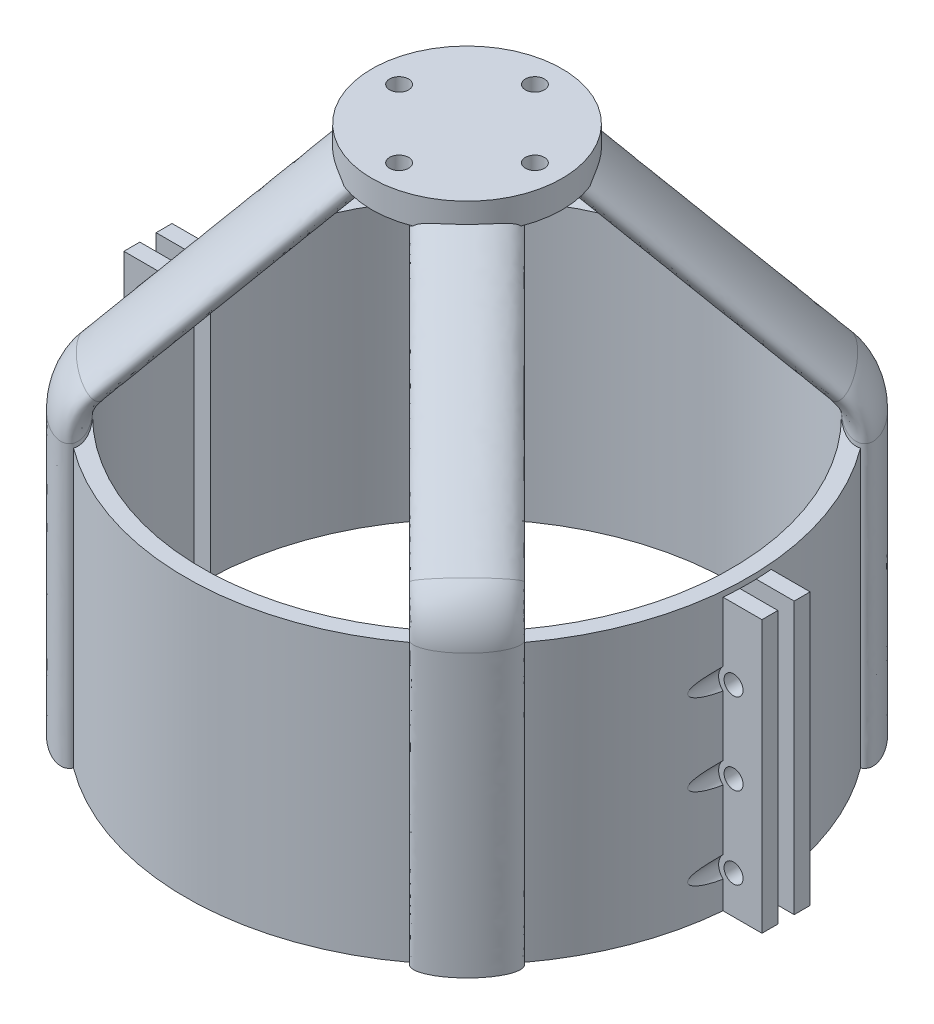
from build123d import *

# Parameters (mm, degrees)
BOSS_EXTRUDE1_DEPTH      = 50
BOSS_EXTRUDE1_2_DEPTH    = 50
SKETCH2_R                = 1.75
CUT_EXTRUDE1_DEPTH       = 96.421557242
CUT_EXTRUDE3_START       = 50
SKETCH3_R                = 2.75
SKETCH3_R_2              = 1.75
CUT_EXTRUDE3_DEPTH       = 50
SKETCH5_R                = 2.75
SKETCH5_R_2              = 1.75
CUT_EXTRUDE4_DEPTH       = 50
SKETCH10_RX              = 7.5
SKETCH10_RY              = 3
SKETCH11_R               = 51.75
SKETCH11_R_2             = 48.75
BOSS_EXTRUDE2_DEPTH      = 1
CIRPATTERN3_COUNT        = 4
BOSS_EXTRUDE3_DEPTH      = 2.5
BOSS_EXTRUDE3_DEPTH_BACK = 2.5
SKETCH12_R               = 17.5
SKETCH13_R               = 1.75
CUT_EXTRUDE5_DEPTH       = 5


with BuildPart() as part:
    # Sketch1 → Boss-Extrude1 (new body)
    with BuildSketch(Plane(origin=(0, 0, 0), x_dir=(1, 0, 0), z_dir=(0, 1, 0))):
        with BuildLine():
            Line((-58.726917612, -4.432049928), (-51.55986262, -4.432049928))
            ThreePointArc((-51.55986262, -4.432049928), (0, -51.75), (51.55986262, -4.432049928))
            Line((51.55986262, -4.432049928), (58.726917612, -4.432049928))
            Line((58.726917612, -4.432049928), (58.726917612, -1.5))
            Line((58.726917612, -1.5), (48.726917612, -1.5))
            ThreePointArc((48.726917612, -1.5), (0, -48.75), (-48.726917612, -1.5))
            Line((-48.726917612, -1.5), (-58.726917612, -1.5))
            Line((-58.726917612, -1.5), (-58.726917612, -4.432049928))
        make_face()
    extrude(amount=BOSS_EXTRUDE1_DEPTH)


with BuildPart() as body_2:
    # Sketch1 → Boss-Extrude1 2 (new body)
    with BuildSketch(Plane(origin=(0, 0, 0), x_dir=(1, 0, 0), z_dir=(0, 1, 0))):
        with BuildLine():
            ThreePointArc((51.55986262, 4.432049928), (0, 51.75), (-51.55986262, 4.432049928))
            Line((-51.55986262, 4.432049928), (-58.726917612, 4.432049928))
            Line((-58.726917612, 4.432049928), (-58.726917612, 1.5))
            Line((-58.726917612, 1.5), (-48.726917612, 1.5))
            ThreePointArc((-48.726917612, 1.5), (0, 48.75), (48.726917612, 1.5))
            Line((48.726917612, 1.5), (58.726917612, 1.5))
            Line((58.726917612, 1.5), (58.726917612, 4.432049928))
            Line((58.726917612, 4.432049928), (51.55986262, 4.432049928))
        make_face()
    extrude(amount=BOSS_EXTRUDE1_2_DEPTH)


with BuildPart() as cut_extrude1_tool:
    # Sketch2 → Cut-Extrude1 (new, through all)
    with BuildSketch(Plane.XY.offset(4.432049928)):
        with Locations((-53.5, 7)):
            Circle(SKETCH2_R)
        with Locations((-53.5, 22)):
            Circle(SKETCH2_R)
        with Locations((-53.5, 37)):
            Circle(SKETCH2_R)
        with Locations((53.5, 7)):
            Circle(SKETCH2_R)
        with Locations((53.5, 22)):
            Circle(SKETCH2_R)
        with Locations((53.5, 37)):
            Circle(SKETCH2_R)
    extrude(amount=-CUT_EXTRUDE1_DEPTH)


with BuildPart() as part_1:
    add(part.part)

    # Cut-Extrude1: cut by cut_extrude1_tool
    add(cut_extrude1_tool.part, mode=Mode.SUBTRACT)

    # Sketch3 → Cut-Extrude3 (cut)
    # profile 1 of 6: a face of its own
    with BuildSketch(Plane.XY.offset(4.432049928).offset(CUT_EXTRUDE3_START)):
        with Locations((-53.5, 37)):
            Circle(SKETCH3_R)
        with Locations((-53.5, 37)):
            Circle(SKETCH3_R_2, mode=Mode.SUBTRACT)
    # profile 2 of 6: a face of its own
    with BuildSketch(Plane.XY.offset(4.432049928).offset(CUT_EXTRUDE3_START)):
        with Locations((-53.5, 22)):
            Circle(SKETCH3_R)
        with Locations((-53.5, 22)):
            Circle(SKETCH3_R_2, mode=Mode.SUBTRACT)
    # profile 3 of 6: a face of its own
    with BuildSketch(Plane.XY.offset(4.432049928).offset(CUT_EXTRUDE3_START)):
        with Locations((-53.5, 7)):
            Circle(SKETCH3_R)
        with Locations((-53.5, 7)):
            Circle(SKETCH3_R_2, mode=Mode.SUBTRACT)
    # profile 4 of 6: a face of its own
    with BuildSketch(Plane.XY.offset(4.432049928).offset(CUT_EXTRUDE3_START)):
        with Locations((53.5, 7)):
            Circle(SKETCH3_R)
        with Locations((53.5, 7)):
            Circle(SKETCH3_R_2, mode=Mode.SUBTRACT)
    # profile 5 of 6: a face of its own
    with BuildSketch(Plane.XY.offset(4.432049928).offset(CUT_EXTRUDE3_START)):
        with Locations((53.5, 22)):
            Circle(SKETCH3_R)
        with Locations((53.5, 22)):
            Circle(SKETCH3_R_2, mode=Mode.SUBTRACT)
    # profile 6 of 6: a face of its own
    with BuildSketch(Plane.XY.offset(4.432049928).offset(CUT_EXTRUDE3_START)):
        with Locations((53.5, 37)):
            Circle(SKETCH3_R)
        with Locations((53.5, 37)):
            Circle(SKETCH3_R_2, mode=Mode.SUBTRACT)
    extrude(amount=-CUT_EXTRUDE3_DEPTH, mode=Mode.SUBTRACT)

    # Sweep1: sweep along a path in Sketch9
    with BuildLine(Plane(origin=(0, 0, 0), x_dir=(0.7071067811865475, 0, -0.7071067811865477), z_dir=(0.7071067811865477, 0, 0.7071067811865475))) as sweep1_path:
        Line((-51.75, 0), (-51.75, 51.772072046))
        ThreePointArc((-51.75, 51.772072046), (-50.971269713, 55.640945896), (-48.756363025, 58.907257899))
        Line((-48.756363025, 58.907257899), (-12, 95))
    # Sketch10 → Sweep1 (sweep)
    with BuildSketch(Plane.XZ):
        with Locations(Location((-36.592775926, 36.592775926), (0, 0, 45))):
            Ellipse(SKETCH10_RX, SKETCH10_RY)
    sweep1 = sweep(path=sweep1_path.line)



with BuildPart() as body_2_1:
    add(body_2.part)

    # Cut-Extrude1: cut by cut_extrude1_tool
    add(cut_extrude1_tool.part, mode=Mode.SUBTRACT)

    # Sketch5 → Cut-Extrude4 (cut)
    # profile 1 of 6: a face of its own
    with BuildSketch(Plane(origin=(0, 0, -4.432049928), x_dir=(-1, 0, 0), z_dir=(0, 0, -1))):
        with Locations((-53.5, 37)):
            Circle(SKETCH5_R)
        with Locations(Location((-53.5, 37, 0), (0, 0, 180))):
            Circle(SKETCH5_R_2, mode=Mode.SUBTRACT)
    # profile 2 of 6: a face of its own
    with BuildSketch(Plane(origin=(0, 0, -4.432049928), x_dir=(-1, 0, 0), z_dir=(0, 0, -1))):
        with Locations((-53.5, 22)):
            Circle(SKETCH5_R)
        with Locations(Location((-53.5, 22, 0), (0, 0, 180))):
            Circle(SKETCH5_R_2, mode=Mode.SUBTRACT)
    # profile 3 of 6: a face of its own
    with BuildSketch(Plane(origin=(0, 0, -4.432049928), x_dir=(-1, 0, 0), z_dir=(0, 0, -1))):
        with Locations((-53.5, 7)):
            Circle(SKETCH5_R)
        with Locations(Location((-53.5, 7, 0), (0, 0, 180))):
            Circle(SKETCH5_R_2, mode=Mode.SUBTRACT)
    # profile 4 of 6: a face of its own
    with BuildSketch(Plane(origin=(0, 0, -4.432049928), x_dir=(-1, 0, 0), z_dir=(0, 0, -1))):
        with Locations((53.5, 7)):
            Circle(SKETCH5_R)
        with Locations(Location((53.5, 7, 0), (0, 0, 180))):
            Circle(SKETCH5_R_2, mode=Mode.SUBTRACT)
    # profile 5 of 6: a face of its own
    with BuildSketch(Plane(origin=(0, 0, -4.432049928), x_dir=(-1, 0, 0), z_dir=(0, 0, -1))):
        with Locations((53.5, 22)):
            Circle(SKETCH5_R)
        with Locations(Location((53.5, 22, 0), (0, 0, 180))):
            Circle(SKETCH5_R_2, mode=Mode.SUBTRACT)
    # profile 6 of 6: a face of its own
    with BuildSketch(Plane(origin=(0, 0, -4.432049928), x_dir=(-1, 0, 0), z_dir=(0, 0, -1))):
        with Locations((53.5, 37)):
            Circle(SKETCH5_R)
        with Locations(Location((53.5, 37, 0), (0, 0, 180))):
            Circle(SKETCH5_R_2, mode=Mode.SUBTRACT)
    extrude(amount=CUT_EXTRUDE4_DEPTH, mode=Mode.SUBTRACT)


with BuildPart() as part_2:
    add(part_1.part)

    add(body_2_1.part)  # Boss-Extrude2 merges body 2
    # Sketch11 → Boss-Extrude2 (add)
    with BuildSketch(Plane(origin=(0, 50, 0), x_dir=(1, 0, 0), z_dir=(0, 1, 0))):
        Circle(SKETCH11_R)
        with Locations(Location((0, 0, 0), (0, 0, 45))):
            Circle(SKETCH11_R_2, mode=Mode.SUBTRACT)
    extrude(amount=BOSS_EXTRUDE2_DEPTH)

    # CirPattern3: Sweep1 ×4 about axis
    cirpattern3_axis = Axis((0, 50, 0), (0, 1, 0))
    for i in range(1, CIRPATTERN3_COUNT):
        add(sweep1.rotate(cirpattern3_axis, i * 360 / CIRPATTERN3_COUNT))

    # Sketch12 → Boss-Extrude3 (add, two sides: drawn at the far end of the back side and taken through both)
    with BuildSketch(Plane(origin=(0, 95, 0), x_dir=(1, 0, 0), z_dir=(0, 1, 0)).offset(-BOSS_EXTRUDE3_DEPTH_BACK)):
        with Locations(Location((0, 0, 0), (0, 0, 270))):
            Circle(SKETCH12_R)
    extrude(amount=BOSS_EXTRUDE3_DEPTH + BOSS_EXTRUDE3_DEPTH_BACK)

    # Sketch13 → Cut-Extrude5 (cut)
    with BuildSketch(Plane(origin=(0, 97.5, 0), x_dir=(1, 0, 0), z_dir=(0, 1, 0))):
        with Locations(Location((0, 12.5, 0), (0, 0, 270))):
            Circle(SKETCH13_R)
        with Locations(Location((12.5, 0, 0), (0, 0, 270))):
            Circle(SKETCH13_R)
        with Locations(Location((0, -12.5, 0), (0, 0, 270))):
            Circle(SKETCH13_R)
        with Locations(Location((-12.5, 0, 0), (0, 0, 270))):
            Circle(SKETCH13_R)
    extrude(amount=-CUT_EXTRUDE5_DEPTH, mode=Mode.SUBTRACT)


solid = part_2.part
